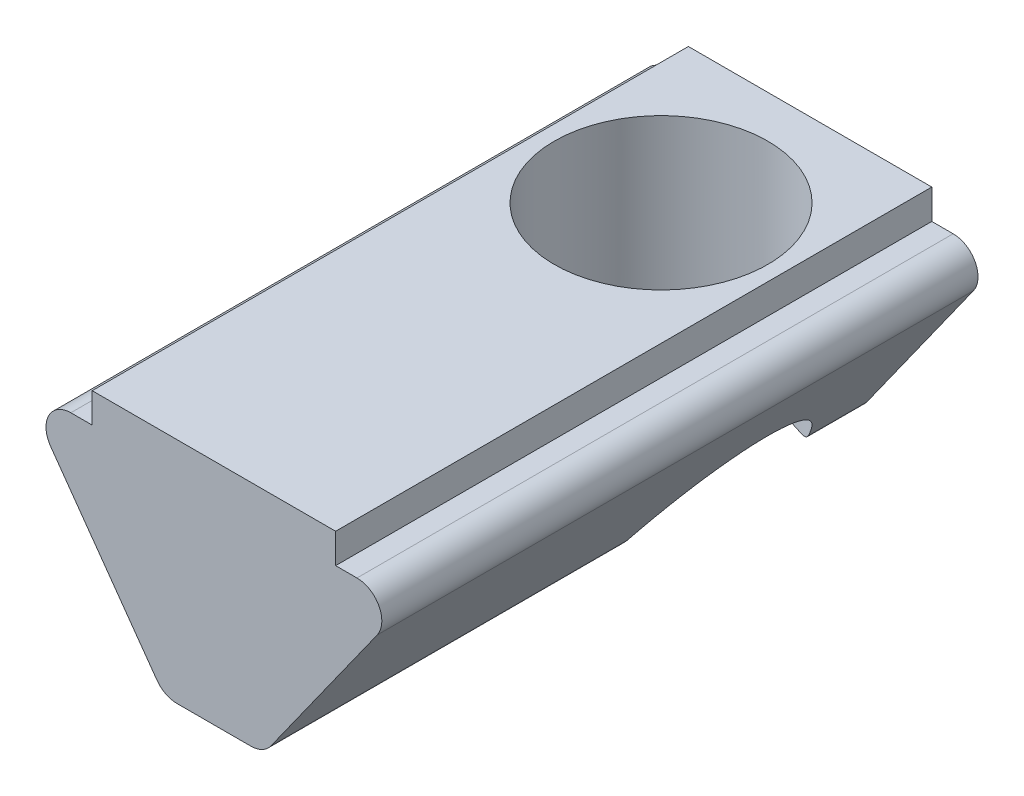
from build123d import *

# Parameters (mm, degrees)
BOSS_EXTRU_1_DEPTH      = 6
CONG_1_R                = 0.5
ENL_V_MAT_EXTRU_1_REACH = 10.281
ESQUISSE2_R             = 2.15


with BuildPart() as part:
    # Esquisse1 → Boss.-Extru.1 (new, symmetric)
    with BuildSketch(Plane.XY):
        Polygon((-2.45, 0), (2.45, 0), (2.45, -0.6), (3.85, -0.6), (1, -4.6), (-1, -4.6), (-3.85, -0.6), (-2.45, -0.6), align=None)
    extrude(amount=BOSS_EXTRU_1_DEPTH, both=True)

    # Congé1
    cong_1_edges = [part.edges().sort_by_distance(p)[0] for p in [
        (3.85, -0.6, 0),
        (1, -4.6, 0),
        (-1, -4.6, 0),
        (-3.85, -0.6, 0),
    ]]
    fillet(cong_1_edges, radius=CONG_1_R)

    # Esquisse2 → Enlèv. mat.-Extru.1 (cut, up to next)
    with BuildSketch(Plane(origin=(0, 0, 0), x_dir=(1, 0, 0), z_dir=(0, 1, 0)), mode=Mode.PRIVATE) as enl_v_mat_extru_1_sk1:
        with Locations(Location((0, 3, 0), (0, 0, 180))):
            Circle(ESQUISSE2_R)
    enl_v_mat_extru_1_tool1 = extrude(enl_v_mat_extru_1_sk1.sketch, amount=-ENL_V_MAT_EXTRU_1_REACH, mode=Mode.PRIVATE) & part.part
    add(enl_v_mat_extru_1_tool1.solids().sort_by_distance((0, 0, -3))[0], mode=Mode.SUBTRACT)


solid = part.part
